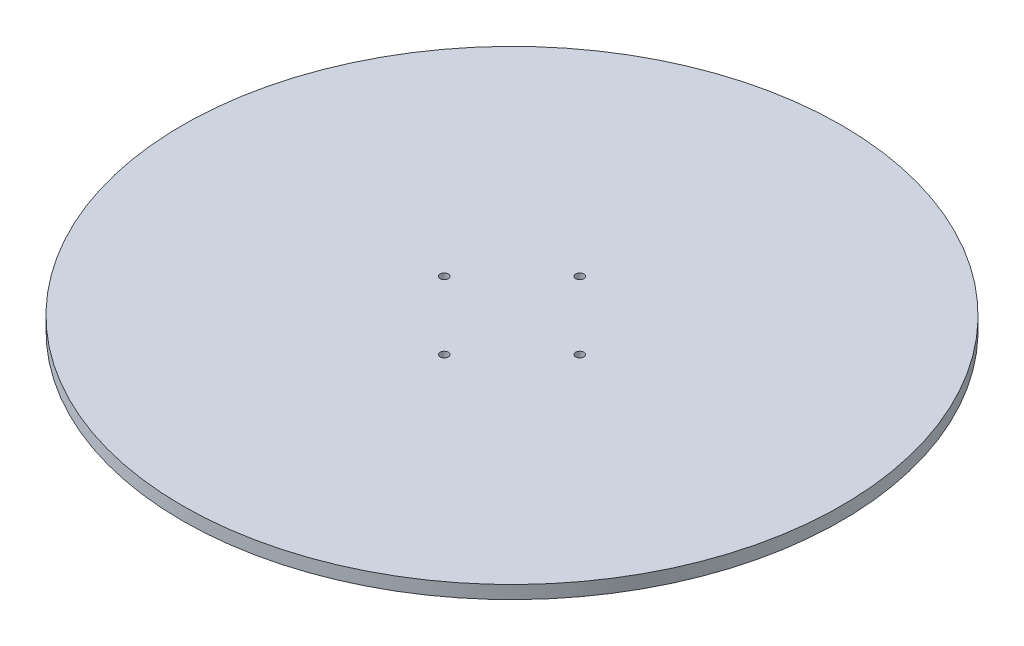
from build123d import *

# Parameters (mm, degrees)
SKETCH1_R           = 80
BOSS_EXTRUDE1_DEPTH = 1.5875
SKETCH2_R           = 1
SKETCH2_R_2         = 0.85
CUT_EXTRUDE2_DEPTH  = 114.181626711


with BuildPart() as part:
    # Sketch1 → Boss-Extrude1 (new, symmetric)
    with BuildSketch(Plane(origin=(0, 0, 0), x_dir=(1, 0, 0), z_dir=(0, 1, 0))):
        with Locations(Location((0, 0, 0), (0, 0, 270))):
            Circle(SKETCH1_R)
    extrude(amount=BOSS_EXTRUDE1_DEPTH, both=True)

    # Sketch2 → Cut-Extrude2 (cut, through all)
    # profile 1 of 8: a face of its own
    with BuildSketch(Plane.XZ.offset(1.5875)):
        with Locations(Location((16.45, 0, 0), (0, 0, 270))):
            Circle(SKETCH2_R)
        with Locations((16.45, 0)):
            Circle(SKETCH2_R_2, mode=Mode.SUBTRACT)
    # profile 2 of 8: a face of its own
    with BuildSketch(Plane.XZ.offset(1.5875)):
        with Locations((16.45, 0)):
            Circle(SKETCH2_R_2)
    # profile 3 of 8: a face of its own
    with BuildSketch(Plane.XZ.offset(1.5875)):
        with Locations(Location((0, -16.45, 0), (0, 0, 270))):
            Circle(SKETCH2_R)
        with Locations((0, -16.45)):
            Circle(SKETCH2_R_2, mode=Mode.SUBTRACT)
    # profile 4 of 8: a face of its own
    with BuildSketch(Plane.XZ.offset(1.5875)):
        with Locations((0, -16.45)):
            Circle(SKETCH2_R_2)
    # profile 5 of 8: a face of its own
    with BuildSketch(Plane.XZ.offset(1.5875)):
        with Locations(Location((-16.45, 0, 0), (0, 0, 270))):
            Circle(SKETCH2_R)
        with Locations((-16.45, 0)):
            Circle(SKETCH2_R_2, mode=Mode.SUBTRACT)
    # profile 6 of 8: a face of its own
    with BuildSketch(Plane.XZ.offset(1.5875)):
        with Locations((-16.45, 0)):
            Circle(SKETCH2_R_2)
    # profile 7 of 8: a face of its own
    with BuildSketch(Plane.XZ.offset(1.5875)):
        with Locations(Location((0, 16.45, 0), (0, 0, 270))):
            Circle(SKETCH2_R)
        with Locations((0, 16.45)):
            Circle(SKETCH2_R_2, mode=Mode.SUBTRACT)
    # profile 8 of 8: a face of its own
    with BuildSketch(Plane.XZ.offset(1.5875)):
        with Locations((0, 16.45)):
            Circle(SKETCH2_R_2)
    extrude(amount=-CUT_EXTRUDE2_DEPTH, mode=Mode.SUBTRACT)


solid = part.part
